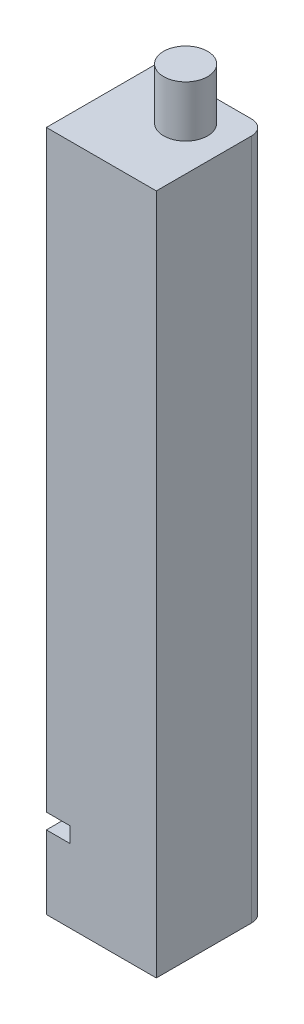
from build123d import *

# Parameters (mm, degrees)
SKETCH1_W           = 15
SKETCH1_H           = 15
BOSS_EXTRUDE1_DEPTH = 93
SKETCH2_R           = 3
BOSS_EXTRUDE2_DEPTH = 7
SKETCH3_W           = 3.2
SKETCH3_H           = 2.1
CUT_EXTRUDE1_DEPTH  = 102.396498953
FILLET1_R           = 2


with BuildPart() as part:
    # Sketch1 → Boss-Extrude1 (new body)
    with BuildSketch(Plane(origin=(0, 0, 0), x_dir=(1, 0, 0), z_dir=(0, 1, 0))):
        Rectangle(SKETCH1_W, SKETCH1_H)
    extrude(amount=BOSS_EXTRUDE1_DEPTH)

    # Sketch2 → Boss-Extrude2 (add)
    with BuildSketch(Plane(origin=(0, 93, 0), x_dir=(1, 0, 0), z_dir=(0, 1, 0))):
        with Locations(Location((1.5, 2.5, 0), (0, 0, 270))):
            Circle(SKETCH2_R)
    extrude(amount=BOSS_EXTRUDE2_DEPTH)

    # Sketch3 → Cut-Extrude1 (cut, through all)
    with BuildSketch(Plane.XY.offset(7.5)):
        with Locations((-5.9, 11.05)):
            Rectangle(SKETCH3_W, SKETCH3_H)
    extrude(amount=-CUT_EXTRUDE1_DEPTH, mode=Mode.SUBTRACT)

    # Fillet1
    fillet1_edges = [part.edges().sort_by_distance(p)[0] for p in [
        (7.5, 46.5, -7.5),
    ]]
    fillet(fillet1_edges, radius=FILLET1_R)


solid = part.part
